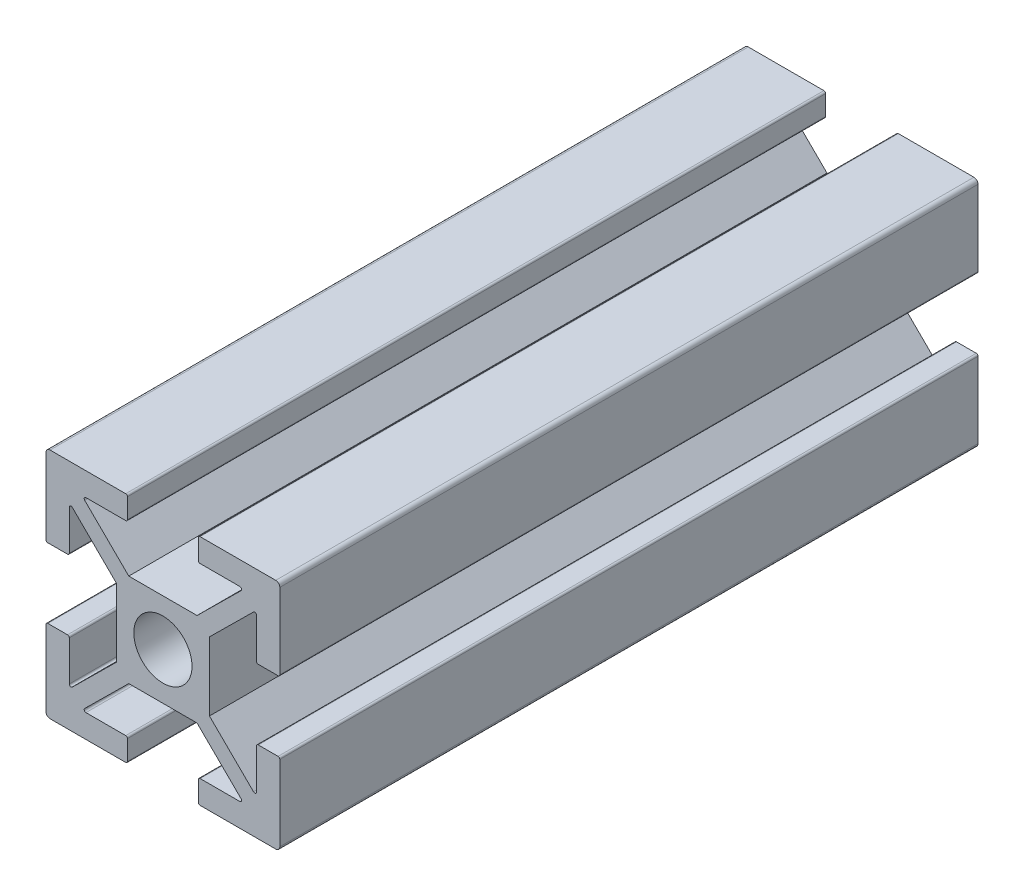
from build123d import *

# Parameters (mm, degrees)
SKETCH1_R           = 2.5
BOSS_EXTRUDE1_DEPTH = 60


with BuildPart() as part:
    # Sketch1 → Boss-Extrude1 (new body)
    with BuildSketch(Plane.XY):
        with BuildLine():
            Line((-31.376404226, -0.06181021), (-29.676404226, -0.06181021))
            ThreePointArc((-29.676404226, -0.06181021), (-29.570338208, -0.017876227), (-29.526404226, 0.08818979))
            Line((-29.526404226, 0.08818979), (-29.526404226, 3.524374304))
            ThreePointArc((-29.526404226, 3.524374304), (-29.43420518, 3.662790523), (-29.27095023, 3.631048831))
            Line((-29.27095023, 3.631048831), (-25.480107929, -0.116419988))
            Line((-25.480107929, -0.116419988), (-25.480107929, -6.007200432))
            Line((-25.480107929, -6.007200432), (-29.27095023, -9.754669251))
            ThreePointArc((-29.27095023, -9.754669251), (-29.43420518, -9.786410942), (-29.526404226, -9.647994723))
            Line((-29.526404226, -9.647994723), (-29.526404226, -6.21181021))
            ThreePointArc((-29.526404226, -6.21181021), (-29.570338208, -6.105744193), (-29.676404226, -6.06181021))
            Line((-29.676404226, -6.06181021), (-31.376404226, -6.06181021))
            ThreePointArc((-31.376404226, -6.06181021), (-31.482470243, -6.105744193), (-31.526404226, -6.21181021))
            Line((-31.526404226, -6.21181021), (-31.526404226, -12.71181021))
            ThreePointArc((-31.526404226, -12.71181021), (-31.423891599, -12.959297583), (-31.176404226, -13.06181021))
            Line((-31.176404226, -13.06181021), (-24.676404226, -13.06181021))
            ThreePointArc((-24.676404226, -13.06181021), (-24.570338208, -13.017876227), (-24.526404226, -12.91181021))
            Line((-24.526404226, -12.91181021), (-24.526404226, -11.21181021))
            ThreePointArc((-24.526404226, -11.21181021), (-24.570338208, -11.105744193), (-24.676404226, -11.06181021))
            Line((-24.676404226, -11.06181021), (-28.094489023, -11.06181021))
            ThreePointArc((-28.094489023, -11.06181021), (-28.233235517, -10.96881381), (-28.199943018, -10.805135682))
            Line((-28.199943018, -10.805135682), (-24.41329202, -7.06181021))
            Line((-24.41329202, -7.06181021), (-18.546923839, -7.06181021))
            Line((-18.546923839, -7.06181021), (-14.760272841, -10.805135682))
            ThreePointArc((-14.760272841, -10.805135682), (-14.726980342, -10.96881381), (-14.865726836, -11.06181021))
            Line((-14.865726836, -11.06181021), (-18.283811633, -11.06181021))
            ThreePointArc((-18.283811633, -11.06181021), (-18.38987765, -11.105744193), (-18.433811633, -11.21181021))
            Line((-18.433811633, -11.21181021), (-18.433811633, -12.91181021))
            ThreePointArc((-18.433811633, -12.91181021), (-18.38987765, -13.017876227), (-18.283811633, -13.06181021))
            Line((-18.283811633, -13.06181021), (-11.783811633, -13.06181021))
            ThreePointArc((-11.783811633, -13.06181021), (-11.53632426, -12.959297583), (-11.433811633, -12.71181021))
            Line((-11.433811633, -12.71181021), (-11.433811633, -6.21181021))
            ThreePointArc((-11.433811633, -6.21181021), (-11.477745616, -6.105744193), (-11.583811633, -6.06181021))
            Line((-11.583811633, -6.06181021), (-13.283811633, -6.06181021))
            ThreePointArc((-13.283811633, -6.06181021), (-13.38987765, -6.105744193), (-13.433811633, -6.21181021))
            Line((-13.433811633, -6.21181021), (-13.433811633, -9.647994723))
            ThreePointArc((-13.433811633, -9.647994723), (-13.526010678, -9.786410942), (-13.689265628, -9.754669251))
            Line((-13.689265628, -9.754669251), (-17.480107929, -6.007200432))
            Line((-17.480107929, -6.007200432), (-17.480107929, -0.116419988))
            Line((-17.480107929, -0.116419988), (-13.689265628, 3.631048831))
            ThreePointArc((-13.689265628, 3.631048831), (-13.526010678, 3.662790523), (-13.433811633, 3.524374304))
            Line((-13.433811633, 3.524374304), (-13.433811633, 0.08818979))
            ThreePointArc((-13.433811633, 0.08818979), (-13.38987765, -0.017876227), (-13.283811633, -0.06181021))
            Line((-13.283811633, -0.06181021), (-11.583811633, -0.06181021))
            ThreePointArc((-11.583811633, -0.06181021), (-11.477745616, -0.017876227), (-11.433811633, 0.08818979))
            Line((-11.433811633, 0.08818979), (-11.433811633, 6.58818979))
            ThreePointArc((-11.433811633, 6.58818979), (-11.53632426, 6.835677164), (-11.783811633, 6.93818979))
            Line((-11.783811633, 6.93818979), (-18.283811633, 6.93818979))
            ThreePointArc((-18.283811633, 6.93818979), (-18.38987765, 6.894255807), (-18.433811633, 6.78818979))
            Line((-18.433811633, 6.78818979), (-18.433811633, 5.08818979))
            ThreePointArc((-18.433811633, 5.08818979), (-18.38987765, 4.982123773), (-18.283811633, 4.93818979))
            Line((-18.283811633, 4.93818979), (-14.865726836, 4.93818979))
            ThreePointArc((-14.865726836, 4.93818979), (-14.726980342, 4.84519339), (-14.760272841, 4.681515262))
            Line((-14.760272841, 4.681515262), (-18.546923839, 0.93818979))
            Line((-18.546923839, 0.93818979), (-24.41329202, 0.93818979))
            Line((-24.41329202, 0.93818979), (-28.199943018, 4.681515262))
            ThreePointArc((-28.199943018, 4.681515262), (-28.233235517, 4.84519339), (-28.094489023, 4.93818979))
            Line((-28.094489023, 4.93818979), (-24.676404226, 4.93818979))
            ThreePointArc((-24.676404226, 4.93818979), (-24.570338208, 4.982123773), (-24.526404226, 5.08818979))
            Line((-24.526404226, 5.08818979), (-24.526404226, 6.78818979))
            ThreePointArc((-24.526404226, 6.78818979), (-24.570338208, 6.894255807), (-24.676404226, 6.93818979))
            Line((-24.676404226, 6.93818979), (-31.176404226, 6.93818979))
            ThreePointArc((-31.176404226, 6.93818979), (-31.423891599, 6.835677164), (-31.526404226, 6.58818979))
            Line((-31.526404226, 6.58818979), (-31.526404226, 0.08818979))
            ThreePointArc((-31.526404226, 0.08818979), (-31.482470243, -0.017876227), (-31.376404226, -0.06181021))
        make_face()
        with Locations((-21.480107929, -3.06181021)):
            Circle(SKETCH1_R, mode=Mode.SUBTRACT)
    extrude(amount=BOSS_EXTRUDE1_DEPTH)


solid = part.part
